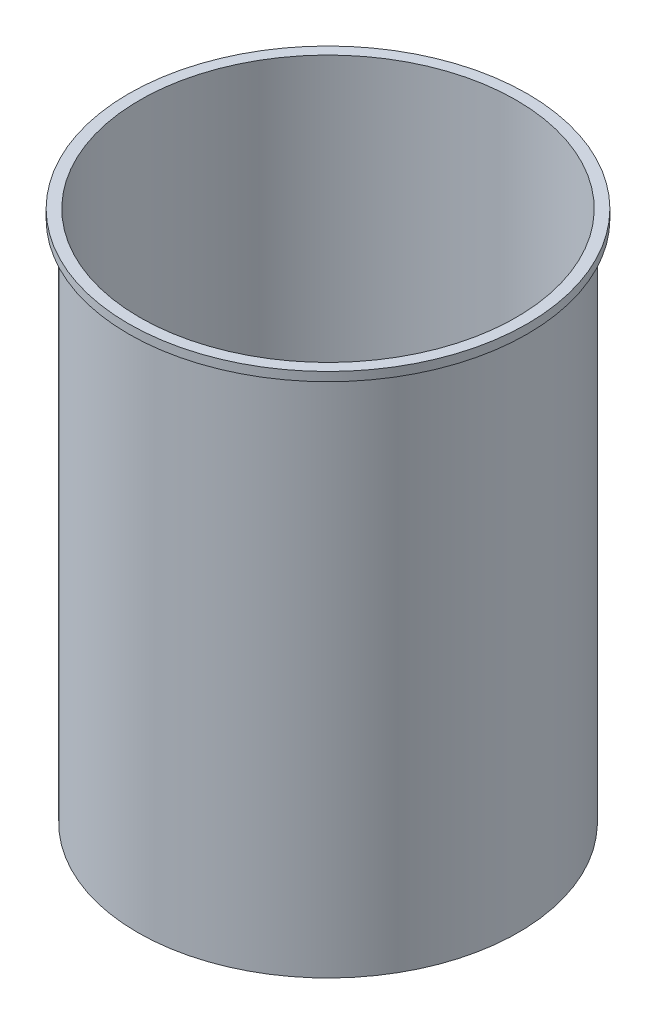
from build123d import *

# Parameters (mm, degrees)
SKETCH1_R           = 43
SKETCH1_R_2         = 42.5
BOSS_EXTRUDE1_DEPTH = 118
SKETCH2_R           = 45
SKETCH2_R_2         = 42.5
BOSS_EXTRUDE3_DEPTH = 2


with BuildPart() as part:
    # Sketch1 → Boss-Extrude1 (new body)
    with BuildSketch(Plane(origin=(0, 0, 0), x_dir=(1, 0, 0), z_dir=(0, 1, 0))):
        with Locations(Location((0, 0, 0), (0, 0, 270))):
            Circle(SKETCH1_R)
        with Locations(Location((0, 0, 0), (0, 0, 270))):
            Circle(SKETCH1_R_2, mode=Mode.SUBTRACT)
    extrude(amount=BOSS_EXTRUDE1_DEPTH)

    # Sketch2 → Boss-Extrude3 (add)
    with BuildSketch(Plane(origin=(0, 118, 0), x_dir=(1, 0, 0), z_dir=(0, 1, 0))):
        with Locations(Location((0, 0, 0), (0, 0, 270))):
            Circle(SKETCH2_R)
        with Locations(Location((0, 0, 0), (0, 0, 270))):
            Circle(SKETCH2_R_2, mode=Mode.SUBTRACT)
    extrude(amount=BOSS_EXTRUDE3_DEPTH)


solid = part.part
